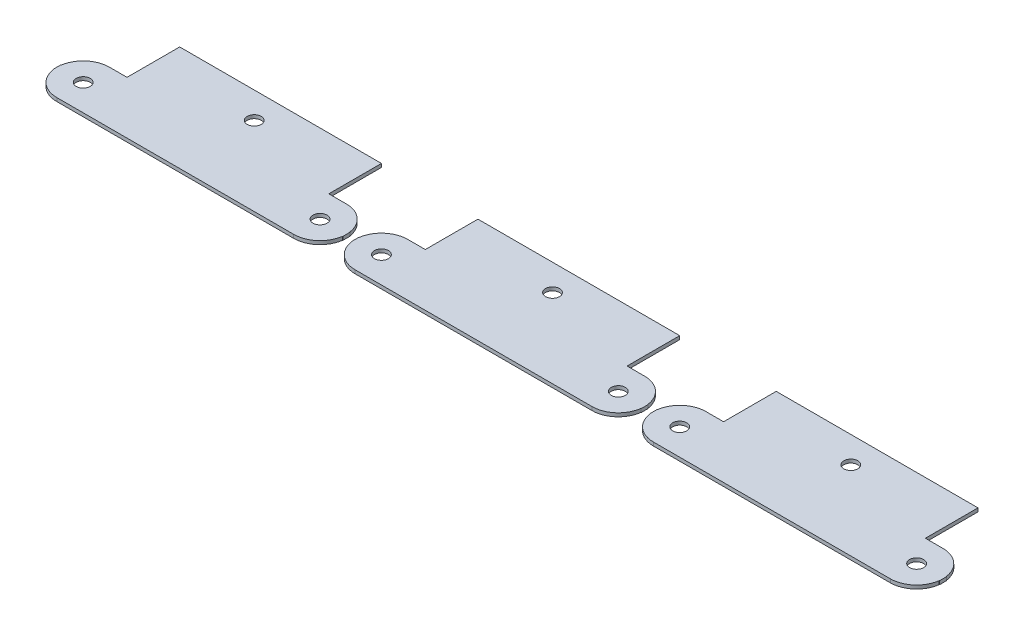
from build123d import *

# Parameters (mm, degrees)
SKETCH1_R           = 2
BOSS_EXTRUDE1_DEPTH = 1
LPATTERN1_COUNT     = 3
LPATTERN1_PITCH     = 85


with BuildPart() as part:
    # Sketch1 → Boss-Extrude1 (new body)
    with BuildSketch(Plane(origin=(0, 0, 0), x_dir=(1, 0, 0), z_dir=(0, 1, 0))):
        with BuildLine():
            Line((0, 7.5), (5, 7.5))
            Line((5, 7.5), (5, 22.5))
            Line((5, 22.5), (62.5, 22.5))
            Line((62.5, 22.5), (62.5, 7.5))
            Line((62.5, 7.5), (67.5, 7.5))
            ThreePointArc((67.5, 7.5), (72.437104415, 5.645794895), (74.933034374, 1))
            Line((74.933034374, 1), (75, 1))
            Line((75, 1), (75, -1))
            Line((75, -1), (74.933034374, -1))
            ThreePointArc((74.933034374, -1), (72.437104415, -5.645794895), (67.5, -7.5))
            Line((67.5, -7.5), (0, -7.5))
            ThreePointArc((0, -7.5), (-4.937104415, -5.645794895), (-7.433034374, -1))
            Line((-7.433034374, -1), (-7.5, -1))
            Line((-7.5, -1), (-7.5, 1))
            Line((-7.5, 1), (-7.433034374, 1))
            ThreePointArc((-7.433034374, 1), (-4.937104415, 5.645794895), (0, 7.5))
        make_face()
        with Locations(Location((0, 0, 0), (0, 0, 270))):
            Circle(SKETCH1_R, mode=Mode.SUBTRACT)
        with Locations(Location((67.5, 0, 0), (0, 0, 270))):
            Circle(SKETCH1_R, mode=Mode.SUBTRACT)
        with Locations(Location((33.75, 15, 0), (0, 0, 270))):
            Circle(SKETCH1_R, mode=Mode.SUBTRACT)
    extrude(amount=BOSS_EXTRUDE1_DEPTH)


with BuildPart() as lpattern1_1:
    # LPattern1: pattern copy
    add(part.part.moved(Location(Vector(1, 0, 0) * (1 * LPATTERN1_PITCH))))


with BuildPart() as lpattern1_2:
    # LPattern1: pattern copy
    add(part.part.moved(Location(Vector(1, 0, 0) * (2 * LPATTERN1_PITCH))))


solid = Compound([part.part, lpattern1_1.part, lpattern1_2.part])
